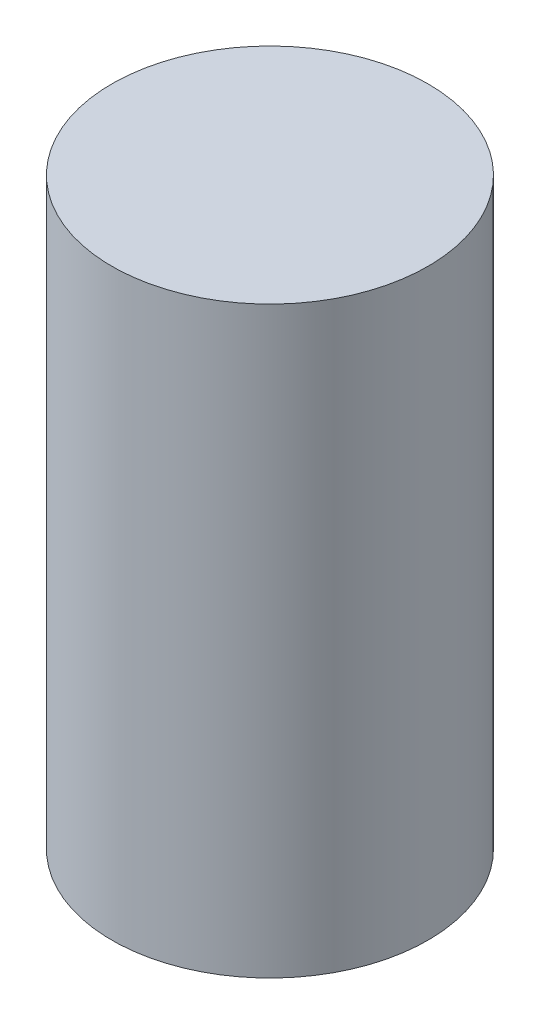
from build123d import *

# Parameters (mm, degrees)
SKETCH1_R           = 20.6375
BOSS_EXTRUDE1_DEPTH = 76.2


with BuildPart() as part:
    # Sketch1 → Boss-Extrude1 (new body)
    with BuildSketch(Plane(origin=(0, 0, 0), x_dir=(1, 0, 0), z_dir=(0, 1, 0))):
        with Locations(Location((0, 0, 0), (0, 0, 90))):
            Circle(SKETCH1_R)
    extrude(amount=BOSS_EXTRUDE1_DEPTH)


solid = part.part
